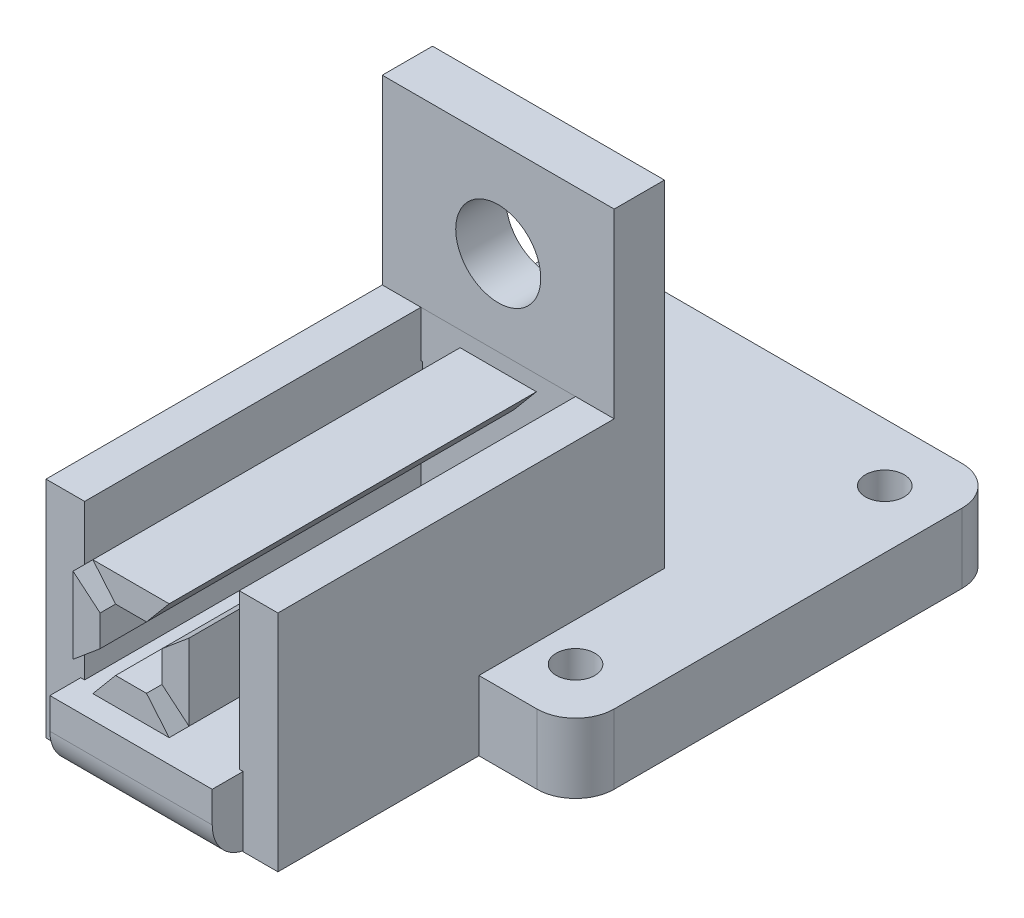
from build123d import *

# Parameters (mm, degrees)
BOSS_EXTRUDE2_DEPTH       = 8
BOSS_EXTRUDE2_DEPTH_BACK  = 1
SKETCH1_R                 = 2.5
SKETCH5_W                 = 9
SKETCH5_H                 = 6.5
BOSS_EXTRUDE3_DEPTH       = 14.5
CUT_EXTRUDE4_DEPTH        = 1.5
SKETCH12_W                = 21
SKETCH12_H                = 30
BOSS_EXTRUDE7_DEPTH       = 9
SKETCH15_W                = 9
SKETCH15_H                = 6.5
BOSS_EXTRUDE8_DEPTH       = 3.5
BOSS_EXTRUDE9_DEPTH       = 54
FILLET4_R                 = 5
SKETCH18_W                = 9.873697418
SKETCH18_H                = 6.5
BOSS_EXTRUDE11_DEPTH      = 0.5
SKETCH20_W                = 4
SKETCH20_H                = 17.5
BOSS_EXTRUDE12_DEPTH      = 18
BOSS_EXTRUDE13_DEPTH      = 11
BOSS_EXTRUDE13_DEPTH_BACK = 4
SKETCH22_W                = 17.5
SKETCH22_H                = 4
SKETCH25_W                = 2
SKETCH25_H                = 17.5
BOSS_EXTRUDE14_DEPTH      = 41
SKETCH28_W                = 41
SKETCH28_H                = 45
BOSS_EXTRUDE15_DEPTH      = 2
SKETCH29_R                = 1.75
CUT_EXTRUDE8_DEPTH        = 9
BOSS_EXTRUDE16_DEPTH      = 9
BOSS_EXTRUDE16_DEPTH_BACK = 4
SKETCH30_W                = 17.5
SKETCH30_H                = 4
SKETCH31_R                = 10
CUT_EXTRUDE9_DEPTH        = 9
SKETCH32_W                = 13
SKETCH32_H                = 4
BOSS_EXTRUDE17_DEPTH      = 23.5
SKETCH33_W                = 0.5
SKETCH33_H                = 17.5
BOSS_EXTRUDE18_DEPTH      = 20
BOSS_EXTRUDE19_DEPTH      = 26
SKETCH35_W                = 9.873697418
SKETCH35_H                = 0.5
BOSS_EXTRUDE20_DEPTH      = 47.5
BOSS_EXTRUDE21_DEPTH      = 47.5
SKETCH38_W                = 0.419549816
SKETCH38_H                = 18.5
CUT_EXTRUDE10_DEPTH       = 90.5
BOSS_EXTRUDE23_DEPTH      = 47.5
SKETCH48_W                = 15.5
SKETCH48_H                = 6.5
BOSS_EXTRUDE31_DEPTH      = 18.5
SKETCH51_W                = 9.626242636
SKETCH51_H                = 9.125298808
BOSS_EXTRUDE32_DEPTH      = 1.5
SKETCH54_W                = 8
SKETCH54_H                = 8
BOSS_EXTRUDE35_DEPTH      = 47.5
SKETCH55_W                = 9.873697418
SKETCH55_H                = 0.5
CUT_EXTRUDE12_DEPTH       = 47.5
SKETCH56_W                = 0.5
SKETCH56_H                = 20
BOSS_EXTRUDE36_DEPTH      = 43.5
BOSS_EXTRUDE37_DEPTH      = 47.5
SKETCH58_W                = 0.715052156
SKETCH58_H                = 9.51279705
CUT_EXTRUDE13_DEPTH       = 4
CUT_EXTRUDE15_DEPTH       = 47.5
SKETCH60_W                = 0.215052156
SKETCH60_H                = 9.51279705
CUT_EXTRUDE16_DEPTH       = 47.5
CUT_EXTRUDE17_DEPTH       = 47.5
SKETCH62_W                = 8
SKETCH62_H                = 8
CUT_EXTRUDE18_DEPTH       = 47.5
SKETCH63_W                = 13
SKETCH63_H                = 4
CUT_EXTRUDE20_DEPTH       = 17
SKETCH64_W                = 1
SKETCH64_H                = 1.5
BOSS_EXTRUDE38_DEPTH      = 6.5
SKETCH68_W                = 2
SKETCH68_H                = 45
CUT_EXTRUDE23_DEPTH       = 17
SKETCH69_W                = 2
SKETCH69_H                = 41
CUT_EXTRUDE24_DEPTH       = 37
CUT_EXTRUDE25_DEPTH       = 6.5
SKETCH72_W                = 43.5
SKETCH72_H                = 4
CUT_EXTRUDE26_DEPTH       = 11
SKETCH73_W                = 43.5
SKETCH73_H                = 4
CUT_EXTRUDE27_DEPTH       = 9
SKETCH74_W                = 6.5
SKETCH74_H                = 18.5
CUT_EXTRUDE28_DEPTH       = 5
SKETCH75_W                = 6.5
SKETCH75_H                = 18.5
CUT_EXTRUDE30_DEPTH       = 5
SKETCH76_W                = 30
SKETCH76_H                = 6.5
BOSS_EXTRUDE39_DEPTH      = 1.5
SKETCH81_W                = 30
SKETCH81_H                = 6.501554737
BOSS_EXTRUDE44_DEPTH      = 23.5
SKETCH82_R                = 1.5
CUT_EXTRUDE31_DEPTH       = 5
CUT_EXTRUDE32_REACH       = 94.7
SKETCH82_4_R              = 5.5


with BuildPart() as part:
    # Sketch1 → Boss-Extrude2 (new, two sides: drawn at the far end of the back side and taken through both)
    with BuildSketch(Plane(origin=(0, 0, 0), x_dir=(1, 0, 0), z_dir=(0, 1, 0)).offset(-BOSS_EXTRUDE2_DEPTH_BACK)):
        with BuildLine():
            Line((5, 0), (50, 0))
            ThreePointArc((50, 0), (53.535533906, 1.464466094), (55, 5))
            Line((55, 5), (55, 50))
            ThreePointArc((55, 50), (53.535533906, 53.535533906), (50, 55))
            Line((50, 55), (5, 55))
            ThreePointArc((5, 55), (1.464466094, 53.535533906), (0, 50))
            Line((0, 50), (0, 5))
            ThreePointArc((0, 5), (1.464466094, 1.464466094), (5, 0))
        make_face()
        with Locations((7.5, 47.5)):
            Circle(SKETCH1_R, mode=Mode.SUBTRACT)
        with Locations((47.5, 47.5)):
            Circle(SKETCH1_R, mode=Mode.SUBTRACT)
        with Locations((47.5, 7.5)):
            Circle(SKETCH1_R, mode=Mode.SUBTRACT)
        with Locations((7.5, 7.5)):
            Circle(SKETCH1_R, mode=Mode.SUBTRACT)
    extrude(amount=BOSS_EXTRUDE2_DEPTH + BOSS_EXTRUDE2_DEPTH_BACK)

    # Sketch5 → Boss-Extrude3 (add)
    with BuildSketch(Plane(origin=(0, 8, 0), x_dir=(1, 0, 0), z_dir=(0, 1, 0))):
        with Locations((27.5, 20.75)):
            Rectangle(SKETCH5_W, SKETCH5_H)
    extrude(amount=BOSS_EXTRUDE3_DEPTH)

    # Sketch6 → Cut-Extrude4 (cut)
    with BuildSketch(Plane(origin=(0, 0, -24), x_dir=(-1, 0, 0), z_dir=(0, 0, -1))):
        with BuildLine():
            ThreePointArc((-27.5, 13), (-24.671572875, 14.171572875), (-23.5, 17))
            ThreePointArc((-23.5, 17), (-30.328427125, 19.828427125), (-27.5, 13))
        make_face()
    extrude(amount=-CUT_EXTRUDE4_DEPTH, mode=Mode.SUBTRACT)

    # Sketch12 → Boss-Extrude7 (add)
    with BuildSketch(Plane(origin=(0, 8, 0), x_dir=(1, 0, 0), z_dir=(0, 1, 0))):
        with Locations((27.5, -15)):
            Rectangle(SKETCH12_W, SKETCH12_H)
    extrude(amount=-BOSS_EXTRUDE7_DEPTH)

    # Sketch15 → Boss-Extrude8 (add)
    with BuildSketch(Plane(origin=(0, 22.5, 0), x_dir=(1, 0, 0), z_dir=(0, 1, 0))):
        with Locations((27.5, 20.75)):
            Rectangle(SKETCH15_W, SKETCH15_H)
    extrude(amount=BOSS_EXTRUDE8_DEPTH)

    # Sketch11 → Boss-Extrude9 (add)
    with BuildSketch(Plane(origin=(0, 0, -24), x_dir=(-1, 0, 0), z_dir=(0, 0, -1))):
        Polygon((-29.5, 22.5), (-25.5, 22.5), (-22.563151291, 26), (-32.436848709, 26), align=None)
    extrude(amount=-BOSS_EXTRUDE9_DEPTH)

    # Fillet4
    fillet4_edges = [part.edges().sort_by_distance(p)[0] for p in [
        (27.5, -1, 30),
    ]]
    fillet(fillet4_edges, radius=FILLET4_R)

    # Sketch18 → Boss-Extrude11 (add)
    with BuildSketch(Plane(origin=(0, 26, 0), x_dir=(1, 0, 0), z_dir=(0, 1, 0))):
        with Locations((27.5, 20.75)):
            Rectangle(SKETCH18_W, SKETCH18_H)
    extrude(amount=BOSS_EXTRUDE11_DEPTH)

    # Sketch20 → Boss-Extrude12 (add)
    with BuildSketch(Plane(origin=(0, 8, 0), x_dir=(1, 0, 0), z_dir=(0, 1, 0))):
        with Locations((14.5, 8.75)):
            Rectangle(SKETCH20_W, SKETCH20_H)
        with Locations((40.5, 8.75)):
            Rectangle(SKETCH20_W, SKETCH20_H)
    extrude(amount=BOSS_EXTRUDE12_DEPTH)

    # Sketch22 → Boss-Extrude13 (add, two sides: drawn at the far end of the back side and taken through both)
    with BuildSketch(Plane.ZY.offset(-12.5).offset(-BOSS_EXTRUDE13_DEPTH_BACK)):
        with Locations((-8.75, 26)):
            Rectangle(SKETCH22_W, SKETCH22_H)
    extrude(amount=BOSS_EXTRUDE13_DEPTH + BOSS_EXTRUDE13_DEPTH_BACK)

    # Sketch25 → Boss-Extrude14 (add)
    with BuildSketch(Plane(origin=(0, 28, 0), x_dir=(1, 0, 0), z_dir=(0, 1, 0))):
        with Locations((2.5, 8.75)):
            Rectangle(SKETCH25_W, SKETCH25_H)
    extrude(amount=BOSS_EXTRUDE14_DEPTH)

    # Sketch28 → Boss-Extrude15 (add)
    with BuildSketch(Plane.ZY.offset(-1.5)):
        with Locations((-20.5, 46.5)):
            Rectangle(SKETCH28_W, SKETCH28_H)
    extrude(amount=-BOSS_EXTRUDE15_DEPTH)

    # Sketch29 → Cut-Extrude8 (cut)
    with BuildSketch(Plane.ZY.offset(-1.5)):
        with Locations((-5, 33)):
            Circle(SKETCH29_R)
        with Locations((-36, 33)):
            Circle(SKETCH29_R)
        with Locations((-36, 64)):
            Circle(SKETCH29_R)
        with Locations((-5, 64)):
            Circle(SKETCH29_R)
    extrude(amount=-CUT_EXTRUDE8_DEPTH, mode=Mode.SUBTRACT)

    # Sketch30 → Boss-Extrude16 (add, two sides: drawn at the far end of the back side and taken through both)
    with BuildSketch(Plane(origin=(42.5, 0, 0), x_dir=(0, 0, -1), z_dir=(1, 0, 0)).offset(-BOSS_EXTRUDE16_DEPTH_BACK)):
        with Locations((8.75, 26)):
            Rectangle(SKETCH30_W, SKETCH30_H)
    extrude(amount=BOSS_EXTRUDE16_DEPTH + BOSS_EXTRUDE16_DEPTH_BACK)

    # Sketch31 → Cut-Extrude9 (cut)
    with BuildSketch(Plane(origin=(3.5, 0, 0), x_dir=(0, 0, -1), z_dir=(1, 0, 0))):
        with Locations((20.5, 47)):
            Circle(SKETCH31_R)
    extrude(amount=-CUT_EXTRUDE9_DEPTH, mode=Mode.SUBTRACT)

    # Sketch32 → Boss-Extrude17 (add)
    with BuildSketch(Plane(origin=(0, 0, -17.5), x_dir=(-1, 0, 0), z_dir=(0, 0, -1))):
        with Locations((-10, 26)):
            Rectangle(SKETCH32_W, SKETCH32_H)
    extrude(amount=BOSS_EXTRUDE17_DEPTH)

    # Sketch33 → Boss-Extrude18 (add)
    with BuildSketch(Plane(origin=(0, 8, 0), x_dir=(1, 0, 0), z_dir=(0, 1, 0))):
        with Locations((38.25, 8.75)):
            Rectangle(SKETCH33_W, SKETCH33_H)
        with Locations((16.75, 8.75)):
            Rectangle(SKETCH33_W, SKETCH33_H)
    extrude(amount=BOSS_EXTRUDE18_DEPTH)

    # Sketch34 → Boss-Extrude19 (add)
    with BuildSketch(Plane.XY):
        Polygon((51.5, 24), (51.5, 28), (38, 28), (38, -1), (42.5, -1), (42.5, 24), align=None)
        Polygon((17, 28), (1.5, 28), (1.5, 24), (12.5, 24), (12.5, -1), (17, -1), align=None)
    extrude(amount=BOSS_EXTRUDE19_DEPTH)

    # Sketch35 → Boss-Extrude20 (add)
    with BuildSketch(Plane.XY.offset(-17.5)):
        with Locations((27.5, 26.25)):
            Rectangle(SKETCH35_W, SKETCH35_H)
    extrude(amount=BOSS_EXTRUDE20_DEPTH)

    # Sketch37 → Boss-Extrude21 (add)
    with BuildSketch(Plane.XY.offset(-17.5)):
        Polygon((29.5, 12), (25.5, 12), (21.863844179, 7.666598237), (33.136155821, 7.666598237), align=None)
    extrude(amount=BOSS_EXTRUDE21_DEPTH)

    # Sketch38 → Cut-Extrude10 (cut)
    with BuildSketch(Plane.XY.offset(30)):
        with Locations((22.353376383, 17.25)):
            Rectangle(SKETCH38_W, SKETCH38_H)
        with Locations((32.646623617, 17.25)):
            Rectangle(SKETCH38_W, SKETCH38_H)
    extrude(amount=-CUT_EXTRUDE10_DEPTH, mode=Mode.SUBTRACT)

    # Sketch39 → Boss-Extrude23 (add)
    with BuildSketch(Plane.XY.offset(30)):
        Polygon((38, 22.006398525), (37.284947844, 22.006398525), (34, 19.25), (34, 15.25), (37.284947844, 12.493601475), (38, 12.493601475), align=None)
        Polygon((21, 19.25), (17.715052156, 22.006398525), (17, 22.006398525), (17, 12.493601475), (17.715052156, 12.493601475), (21, 15.25), align=None)
    extrude(amount=-BOSS_EXTRUDE23_DEPTH)

    # Sketch48 → Boss-Extrude31 (add)
    with BuildSketch(Plane(origin=(0, 8, 0), x_dir=(1, 0, 0), z_dir=(0, 1, 0))):
        with Locations((15.25, 20.75)):
            Rectangle(SKETCH48_W, SKETCH48_H)
        with Locations((39.75, 20.75)):
            Rectangle(SKETCH48_W, SKETCH48_H)
    extrude(amount=BOSS_EXTRUDE31_DEPTH)

    # Sketch51 → Boss-Extrude32 (add)
    with BuildSketch(Plane(origin=(0, 0, -24), x_dir=(-1, 0, 0), z_dir=(0, 0, -1))):
        with Locations((-27.646184708, 17.114099589)):
            Rectangle(SKETCH51_W, SKETCH51_H)
    extrude(amount=-BOSS_EXTRUDE32_DEPTH)

    # Sketch54 → Boss-Extrude35 (add)
    with BuildSketch(Plane.XY.offset(-17.5)):
        with Locations((27.5, 18.5)):
            Rectangle(SKETCH54_W, SKETCH54_H)
    extrude(amount=BOSS_EXTRUDE35_DEPTH)

    # Sketch55 → Cut-Extrude12 (cut)
    with BuildSketch(Plane.XY.offset(30)):
        with Locations((27.5, 26.25)):
            Rectangle(SKETCH55_W, SKETCH55_H)
    extrude(amount=-CUT_EXTRUDE12_DEPTH, mode=Mode.SUBTRACT)

    # Sketch56 → Boss-Extrude36 (add)
    with BuildSketch(Plane.XY.offset(26)):
        with Locations((37.75, 18)):
            Rectangle(SKETCH56_W, SKETCH56_H)
        with Locations((17.25, 18)):
            Rectangle(SKETCH56_W, SKETCH56_H)
    extrude(amount=-BOSS_EXTRUDE36_DEPTH)

    # Sketch57 → Boss-Extrude37 (add)
    with BuildSketch(Plane.XY.offset(30)):
        Polygon((35, 23.436848709), (31.5, 20.5), (31.5, 16.5), (35, 13.563151291), align=None)
        Polygon((20, 13.563151291), (23.5, 16.5), (23.5, 20.5), (20, 23.436848709), align=None)
        Polygon((32.436848709, 11), (29.5, 14.5), (25.5, 14.5), (22.563151291, 11), align=None)
    extrude(amount=-BOSS_EXTRUDE37_DEPTH)

    # Sketch58 → Cut-Extrude13 (cut)
    with BuildSketch(Plane.XY.offset(30)):
        with Locations((37.642473922, 17.25)):
            Rectangle(SKETCH58_W, SKETCH58_H)
        with Locations((17.357526078, 17.25)):
            Rectangle(SKETCH58_W, SKETCH58_H)
    extrude(amount=-CUT_EXTRUDE13_DEPTH, mode=Mode.SUBTRACT)

    # Sketch59 → Cut-Extrude15 (cut)
    with BuildSketch(Plane.XY.offset(30)):
        Polygon((37.284947844, 22.006398525), (35, 20.089099631), (35, 14.410900369), (37.284947844, 12.493601475), align=None)
        Polygon((17.715052156, 22.006398525), (20, 20.089099631), (20, 14.410900369), (17.715052156, 12.493601475), align=None)
    extrude(amount=-CUT_EXTRUDE15_DEPTH, mode=Mode.SUBTRACT)

    # Sketch60 → Cut-Extrude16 (cut)
    with BuildSketch(Plane.XY.offset(26)):
        with Locations((37.392473922, 17.25)):
            Rectangle(SKETCH60_W, SKETCH60_H)
        with Locations((17.607526078, 17.25)):
            Rectangle(SKETCH60_W, SKETCH60_H)
    extrude(amount=-CUT_EXTRUDE16_DEPTH, mode=Mode.SUBTRACT)

    # Sketch61 → Cut-Extrude17 (cut)
    with BuildSketch(Plane.XY.offset(30)):
        Polygon((32.436848709, 8), (22.563151291, 8), (22.563151291, 8.5), (24.660900369, 11), (30.339099631, 11), (32.436848709, 8.5), align=None)
    extrude(amount=-CUT_EXTRUDE17_DEPTH, mode=Mode.SUBTRACT)

    # Sketch62 → Cut-Extrude18 (cut)
    with BuildSketch(Plane.XY.offset(30)):
        with Locations((27.5, 18.5)):
            Rectangle(SKETCH62_W, SKETCH62_H)
    extrude(amount=-CUT_EXTRUDE18_DEPTH, mode=Mode.SUBTRACT)

    # Sketch63 → Cut-Extrude20 (cut)
    with BuildSketch(Plane(origin=(0, 0, -41), x_dir=(-1, 0, 0), z_dir=(0, 0, -1))):
        with Locations((-10, 26)):
            Rectangle(SKETCH63_W, SKETCH63_H)
    extrude(amount=-CUT_EXTRUDE20_DEPTH, mode=Mode.SUBTRACT)

    # Sketch64 → Boss-Extrude38 (add)
    with BuildSketch(Plane(origin=(0, 0, -17.5), x_dir=(-1, 0, 0), z_dir=(0, 0, -1))):
        with Locations((-17, 27.25)):
            Rectangle(SKETCH64_W, SKETCH64_H)
    extrude(amount=BOSS_EXTRUDE38_DEPTH)

    # Sketch68 → Cut-Extrude23 (cut)
    with BuildSketch(Plane(origin=(0, 0, -41), x_dir=(-1, 0, 0), z_dir=(0, 0, -1))):
        with Locations((-2.5, 46.5)):
            Rectangle(SKETCH68_W, SKETCH68_H)
    extrude(amount=-CUT_EXTRUDE23_DEPTH, mode=Mode.SUBTRACT)

    # Sketch69 → Cut-Extrude24 (cut)
    with BuildSketch(Plane(origin=(0, 0, -24), x_dir=(-1, 0, 0), z_dir=(0, 0, -1))):
        with Locations((-2.5, 48.5)):
            Rectangle(SKETCH69_W, SKETCH69_H)
    extrude(amount=-CUT_EXTRUDE24_DEPTH, mode=Mode.SUBTRACT)

    # Sketch70 → Cut-Extrude25 (cut)
    with BuildSketch(Plane(origin=(0, 0, -24), x_dir=(-1, 0, 0), z_dir=(0, 0, -1))):
        Polygon((-17.5, 28), (-17.5, 26.5), (-7.5, 26.5), (-7.5, 24), (-1.5, 24), (-1.5, 28), align=None)
    extrude(amount=-CUT_EXTRUDE25_DEPTH, mode=Mode.SUBTRACT)

    # Sketch72 → Cut-Extrude26 (cut)
    with BuildSketch(Plane.ZY.offset(-1.5)):
        with Locations((4.25, 26)):
            Rectangle(SKETCH72_W, SKETCH72_H)
    extrude(amount=-CUT_EXTRUDE26_DEPTH, mode=Mode.SUBTRACT)

    # Sketch73 → Cut-Extrude27 (cut)
    with BuildSketch(Plane(origin=(51.5, 0, 0), x_dir=(0, 0, -1), z_dir=(1, 0, 0))):
        with Locations((-4.25, 26)):
            Rectangle(SKETCH73_W, SKETCH73_H)
    extrude(amount=-CUT_EXTRUDE27_DEPTH, mode=Mode.SUBTRACT)

    # Sketch74 → Cut-Extrude28 (cut)
    with BuildSketch(Plane.ZY.offset(-7.5)):
        with Locations((-20.75, 17.25)):
            Rectangle(SKETCH74_W, SKETCH74_H)
    extrude(amount=-CUT_EXTRUDE28_DEPTH, mode=Mode.SUBTRACT)

    # Sketch75 → Cut-Extrude30 (cut)
    with BuildSketch(Plane(origin=(47.5, 0, 0), x_dir=(0, 0, -1), z_dir=(1, 0, 0))):
        with Locations((20.75, 17.25)):
            Rectangle(SKETCH75_W, SKETCH75_H)
    extrude(amount=-CUT_EXTRUDE30_DEPTH, mode=Mode.SUBTRACT)

    # Sketch76 → Boss-Extrude39 (add)
    with BuildSketch(Plane(origin=(0, 26.5, 0), x_dir=(1, 0, 0), z_dir=(0, 1, 0))):
        with Locations((27.5, 20.75)):
            Rectangle(SKETCH76_W, SKETCH76_H)
    extrude(amount=BOSS_EXTRUDE39_DEPTH)

    # Sketch81 → Boss-Extrude44 (add)
    with BuildSketch(Plane(origin=(0, 28, 0), x_dir=(1, 0, 0), z_dir=(0, 1, 0))):
        with Locations((27.5, 20.749222632)):
            Rectangle(SKETCH81_W, SKETCH81_H)
    extrude(amount=BOSS_EXTRUDE44_DEPTH)

    # Sketch82 → Cut-Extrude31 (cut)
    with BuildSketch(Plane(origin=(0, 0, -24), x_dir=(-1, 0, 0), z_dir=(0, 0, -1))):
        with Locations((-33.5, 45)):
            Circle(SKETCH82_R)
        with Locations((-21.5, 45)):
            Circle(SKETCH82_R)
        with Locations((-21.5, 33)):
            Circle(SKETCH82_R)
        with Locations((-33.5, 33)):
            Circle(SKETCH82_R)
    extrude(amount=-CUT_EXTRUDE31_DEPTH, mode=Mode.SUBTRACT)

    # Sketch82<4> → Cut-Extrude32 (cut, up to next)
    with BuildSketch(Plane(origin=(0, 0, -24), x_dir=(-1, 0, 0), z_dir=(0, 0, -1)), mode=Mode.PRIVATE) as cut_extrude32_sk1:
        with Locations((-27.5, 39)):
            Circle(SKETCH82_4_R)
    cut_extrude32_tool1 = extrude(cut_extrude32_sk1.sketch, amount=-CUT_EXTRUDE32_REACH, mode=Mode.PRIVATE) & part.part
    add(cut_extrude32_tool1.solids().sort_by_distance((27.5, 39, -24))[0], mode=Mode.SUBTRACT)


solid = part.part
